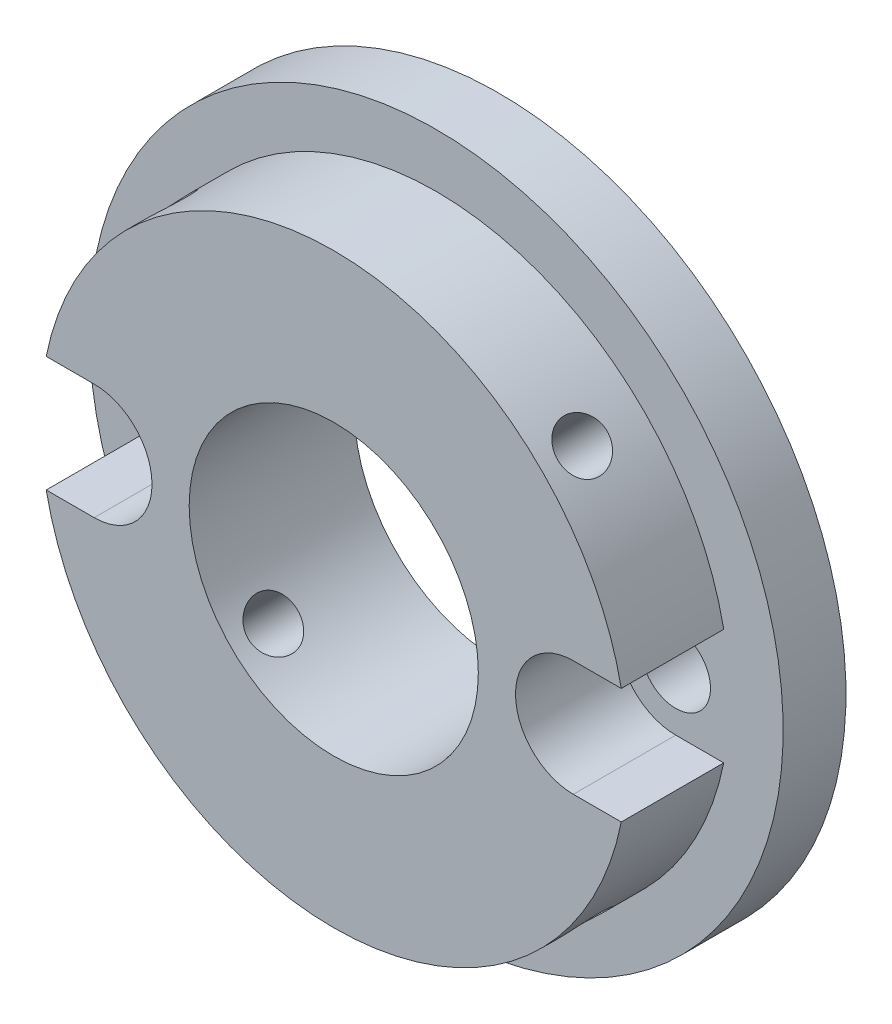
from build123d import *

# Parameters (mm, degrees)
SKETCH_1_R               = 21
EXTRUDE_1_DEPTH          = 3.8
SKETCH_2_R               = 17.75
EXTRUDE_2_DEPTH          = 6.2
SKETCH_3_R               = 2.1
SKETCH_3_R_2             = 8.75
CUT_EXTRUDE_1_DEPTH      = 32.336879232
CUT_EXTRUDE_2_REACH      = 50.491
CUT_EXTRUDE_2_END_RADIUS = 8.75
SKETCH_5_R               = 1.5
PATTERN_CIRCULAR_1_COUNT = 4
CUT_EXTRUDE_3_DEPTH      = 6.2


with BuildPart() as part:
    # ｽｹｯﾁ1 → ﾎﾞｽ - 押し出し1 (new body)
    with BuildSketch(Plane.XY):
        with Locations(Location((0, 0, 0), (0, 0, 180))):
            Circle(SKETCH_1_R)
    extrude(amount=EXTRUDE_1_DEPTH)

    # ｽｹｯﾁ2 → ﾎﾞｽ - 押し出し2 (add)
    with BuildSketch(Plane.XY.offset(3.8)):
        with Locations(Location((0, 0, 0), (0, 0, 180))):
            Circle(SKETCH_2_R)
    extrude(amount=EXTRUDE_2_DEPTH)

    # ｽｹｯﾁ3 → ｶｯﾄ - 押し出し1 (cut, through all)
    with BuildSketch(Plane.XY.offset(10)):
        with Locations((-14.5, 0)):
            Circle(SKETCH_3_R)
        with Locations(Location((14.5, 0, 0), (0, 0, 180))):
            Circle(SKETCH_3_R)
        Circle(SKETCH_3_R_2)
    extrude(amount=-CUT_EXTRUDE_1_DEPTH, mode=Mode.SUBTRACT)

    # ｶｯﾄ - 押し出し2: up to this cylinder (the profile starts outside it)
    cut_extrude_2_end = Plane(origin=(0, 0, 7.5), z_dir=(0, 0, 1)) * Cylinder(CUT_EXTRUDE_2_END_RADIUS, 119.482, mode=Mode.PRIVATE)
    # ｽｹｯﾁ5 → ｶｯﾄ - 押し出し2 (cut, up to the surface)
    with BuildSketch(Plane(origin=(12.551145366, 12.551145366, 0), x_dir=(0.7071067811865489, -0.7071067811865461, 0), z_dir=(0.7071067811865461, 0.7071067811865489, 0)), mode=Mode.PRIVATE) as cut_extrude_2_sk1:
        with Locations(Location((0, -7.5, 0), (0, 0, 180))):
            Circle(SKETCH_5_R)
    cut_extrude_2_tool1 = extrude(cut_extrude_2_sk1.sketch, amount=-CUT_EXTRUDE_2_REACH, mode=Mode.PRIVATE) - cut_extrude_2_end
    cut_extrude_2 = cut_extrude_2_tool1.solids().sort_by_distance((12.551145, 12.551145, 7.5))[0]
    add(cut_extrude_2, mode=Mode.SUBTRACT)

    # 円形ﾊﾟﾀｰﾝ1: ｶｯﾄ - 押し出し2 ×4 about axis
    pattern_circular_1_axis = Axis((0, 0, 10), (0, 0, -1))
    for i in range(1, PATTERN_CIRCULAR_1_COUNT):
        add(cut_extrude_2.rotate(pattern_circular_1_axis, i * 360 / PATTERN_CIRCULAR_1_COUNT), mode=Mode.SUBTRACT)

    # ｽｹｯﾁ6 → ｶｯﾄ - 押し出し3 (cut)
    with BuildSketch(Plane.XY.offset(10)):
        with BuildLine():
            Line((-14.5, -3.5), (-17.75, -3.5))
            ThreePointArc((-17.75, -3.5), (-21.25, 0), (-17.75, 3.5))
            Line((-17.75, 3.5), (-14.5, 3.5))
            ThreePointArc((-14.5, 3.5), (-11, 0), (-14.5, -3.5))
        make_face()
        with BuildLine():
            Line((14.5, -3.5), (17.75, -3.5))
            ThreePointArc((17.75, -3.5), (21.25, 0), (17.75, 3.5))
            Line((17.75, 3.5), (14.5, 3.5))
            ThreePointArc((14.5, 3.5), (11, 0), (14.5, -3.5))
        make_face()
    extrude(amount=-CUT_EXTRUDE_3_DEPTH, mode=Mode.SUBTRACT)


solid = part.part
